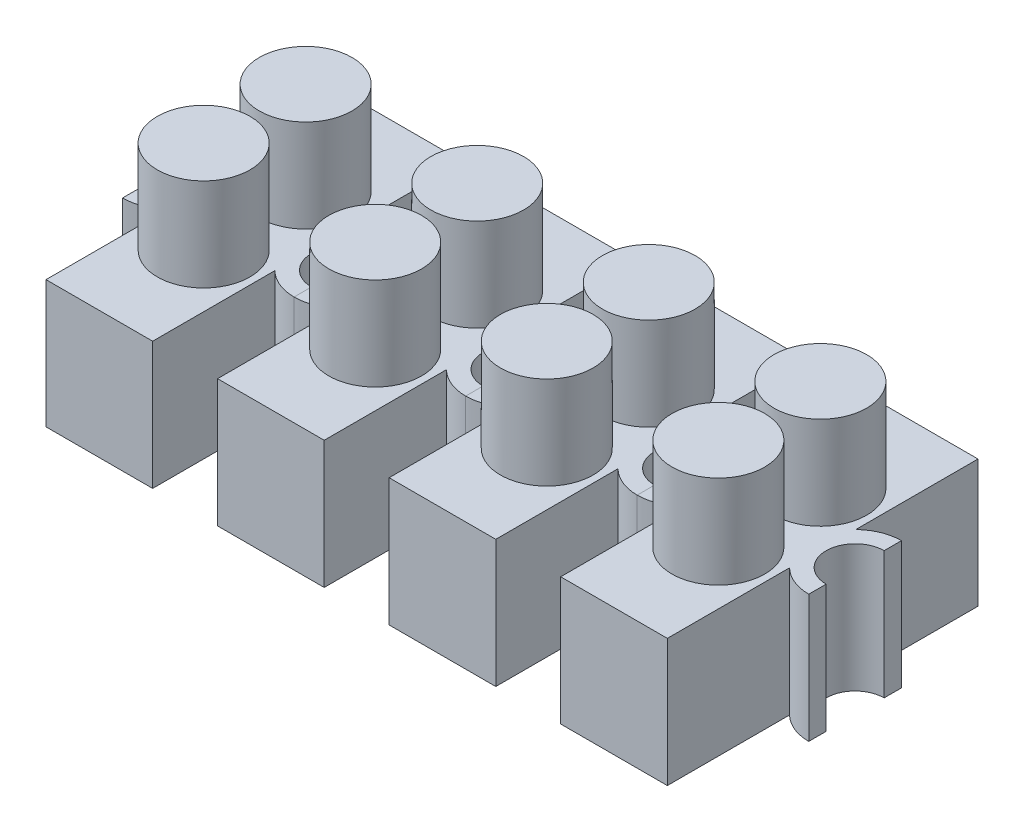
from build123d import *

# Parameters (mm, degrees)
BOSS_EXTRUDE1_DEPTH = 6.985
SKETCH3_W           = 4.572
SKETCH3_H           = 15.494
CUT_EXTRUDE1_DEPTH  = 1.27
SKETCH6_R           = 2.54
BOSS_EXTRUDE3_DEPTH = 5.08
LPATTERN1_COUNT     = 4
LPATTERN1_PITCH     = 9.398


with BuildPart() as part:
    # Sketch2 → Boss-Extrude1 (new body)
    with BuildSketch(Plane(origin=(0, 0, 0), x_dir=(1, 0, 0), z_dir=(0, 1, 0))):
        with BuildLine():
            Line((2.921, 8.509), (-2.921, 8.509))
            Line((-2.921, 8.509), (-2.921, 1.813922821))
            ThreePointArc((-2.921, 1.813922821), (-3.738730237, 2.351485059), (-4.699, 2.54))
            Line((-4.699, 2.54), (-4.699, 1.5875))
            ThreePointArc((-4.699, 1.5875), (-3.1115, 0), (-4.699, -1.5875))
            Line((-4.699, -1.5875), (-4.699, -2.54))
            ThreePointArc((-4.699, -2.54), (-3.738730237, -2.351485059), (-2.921, -1.813922821))
            Line((-2.921, -1.813922821), (-2.921, -8.509))
            Line((-2.921, -8.509), (2.921, -8.509))
            Line((2.921, -8.509), (2.921, -1.813922821))
            ThreePointArc((2.921, -1.813922821), (3.738730237, -2.351485059), (4.699, -2.54))
            Line((4.699, -2.54), (4.699, -1.5875))
            ThreePointArc((4.699, -1.5875), (3.1115, 0), (4.699, 1.5875))
            Line((4.699, 1.5875), (4.699, 2.54))
            ThreePointArc((4.699, 2.54), (3.738730237, 2.351485059), (2.921, 1.813922821))
            Line((2.921, 1.813922821), (2.921, 8.509))
        make_face()
    extrude(amount=BOSS_EXTRUDE1_DEPTH)

    # Sketch3 → Cut-Extrude1 (cut)
    with BuildSketch(Plane.XZ):
        Rectangle(SKETCH3_W, SKETCH3_H)
    extrude(amount=-CUT_EXTRUDE1_DEPTH, mode=Mode.SUBTRACT)

    # Sketch6 → Boss-Extrude3 (add)
    with BuildSketch(Plane(origin=(0, 6.985, 0), x_dir=(1, 0, 0), z_dir=(0, 1, 0))):
        with Locations(Location((0, 2.794, 0), (0, 0, 90))):
            Circle(SKETCH6_R)
        with Locations(Location((0, -2.794, 0), (0, 0, 90))):
            Circle(SKETCH6_R)
    extrude(amount=BOSS_EXTRUDE3_DEPTH)


with BuildPart() as lpattern1_1:
    # LPattern1: pattern copy
    add(part.part.moved(Location(Vector(-1, 0, 0) * (1 * LPATTERN1_PITCH))))


with BuildPart() as lpattern1_2:
    # LPattern1: pattern copy
    add(part.part.moved(Location(Vector(-1, 0, 0) * (2 * LPATTERN1_PITCH))))


with BuildPart() as lpattern1_3:
    # LPattern1: pattern copy
    add(part.part.moved(Location(Vector(-1, 0, 0) * (3 * LPATTERN1_PITCH))))


solid = Compound([part.part, lpattern1_1.part, lpattern1_2.part, lpattern1_3.part])
